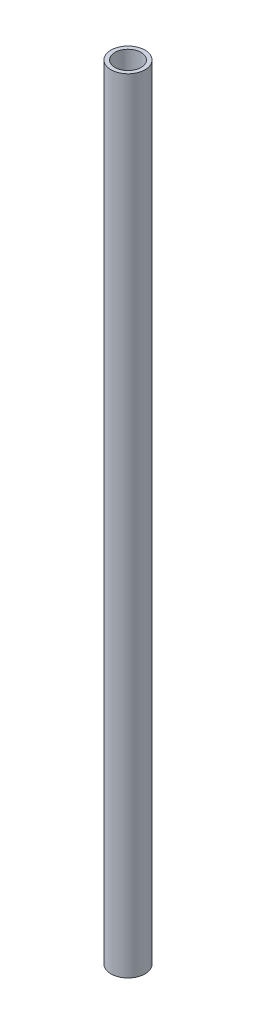
from build123d import *

# Parameters (mm, degrees)
SKETCH1_R           = 6.35
SKETCH1_R_2         = 4.8768
BOSS_EXTRUDE1_DEPTH = 146.05


with BuildPart() as part:
    # Sketch1 → Boss-Extrude1 (new, symmetric)
    with BuildSketch(Plane(origin=(0, 0, 0), x_dir=(1, 0, 0), z_dir=(0, 1, 0))):
        with Locations(Location((0, 0, 0), (0, 0, 270))):
            Circle(SKETCH1_R)
        with Locations(Location((0, 0, 0), (0, 0, 270))):
            Circle(SKETCH1_R_2, mode=Mode.SUBTRACT)
    extrude(amount=BOSS_EXTRUDE1_DEPTH, both=True)


solid = part.part
